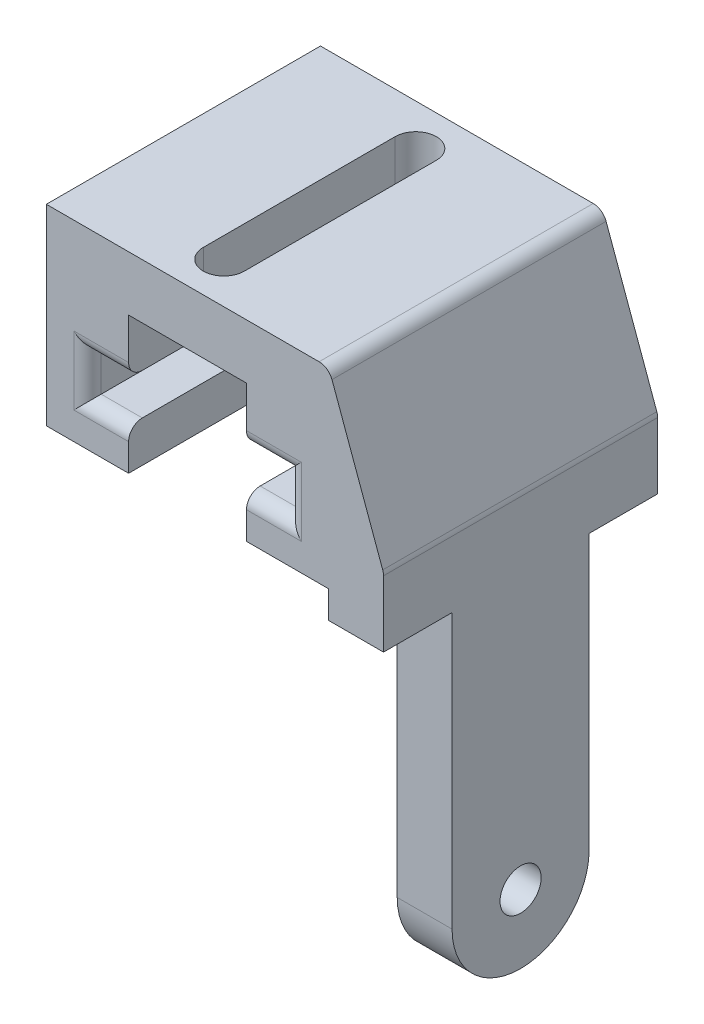
from build123d import *

# Parameters (mm, degrees)
EXTRUDE_1_DEPTH     = 20
SKETCH_2_R          = 1.5
EXTRUDE_2_DEPTH     = 4
FILLET_5_R          = 1
CUT_EXTRUDE_1_REACH = 53.828


with BuildPart() as part:
    # 草图1 → 凸台-拉伸1 (new body)
    with BuildSketch(Plane.XY):
        Polygon((20.6, 14), (24.6, 3), (24.6, -2), (20.6, -2), (20.6, 0), (14.6, 0), (14.6, 3), (17.6, 3), (17.6, 6), (14.6, 6), (14.6, 10), (6, 10), (6, 6), (3, 6), (3, 3), (6, 3), (6, 0), (0, 0), (0, 14), align=None)
    extrude(amount=EXTRUDE_1_DEPTH)

    # 草图2 → 凸台-拉伸2 (add)
    with BuildSketch(Plane(origin=(24.6, 0, 0), x_dir=(0, 0, -1), z_dir=(1, 0, 0))):
        with BuildLine():
            Line((-15, -2), (-5, -2))
            Line((-5, -2), (-5, -22))
            ThreePointArc((-5, -22), (-10, -27), (-15, -22))
            Line((-15, -22), (-15, -2))
        make_face()
        with Locations((-10, -22)):
            Circle(SKETCH_2_R, mode=Mode.SUBTRACT)
    extrude(amount=-EXTRUDE_2_DEPTH)

    # 圆角5
    fillet_5_edges = [part.edges().sort_by_distance(p)[0] for p in [
        (16.1, 3, 0),
        (17.6, 4.5, 0),
        (16.1, 6, 0),
        (4.5, 6, 0),
        (3, 4.5, 0),
        (4.5, 3, 0),
        (4.5, 3, 20),
        (3, 4.5, 20),
        (20.6, 14, 10),
        (24.6, 3, 10),
        (4.5, 6, 20),
        (16.1, 6, 20),
        (17.6, 4.5, 20),
        (16.1, 3, 20),
    ]]
    fillet(fillet_5_edges, radius=FILLET_5_R)

    # 草图3 → 切除-拉伸1 (cut, up to next)
    with BuildSketch(Plane(origin=(0, 14, 0), x_dir=(1, 0, 0), z_dir=(0, 1, 0)), mode=Mode.PRIVATE) as cut_extrude_1_sk1:
        with BuildLine():
            Line((8.449786368, -3), (8.449786368, -17))
            ThreePointArc((8.449786368, -17), (9.949786368, -18.5), (11.449786368, -17))
            Line((11.449786368, -17), (11.449786368, -3))
            ThreePointArc((11.449786368, -3), (9.949786368, -1.5), (8.449786368, -3))
        make_face()
    cut_extrude_1_tool1 = extrude(cut_extrude_1_sk1.sketch, amount=-CUT_EXTRUDE_1_REACH, mode=Mode.PRIVATE) & part.part
    add(cut_extrude_1_tool1.solids().sort_by_distance((9.949786, 14, 10))[0], mode=Mode.SUBTRACT)


solid = part.part
